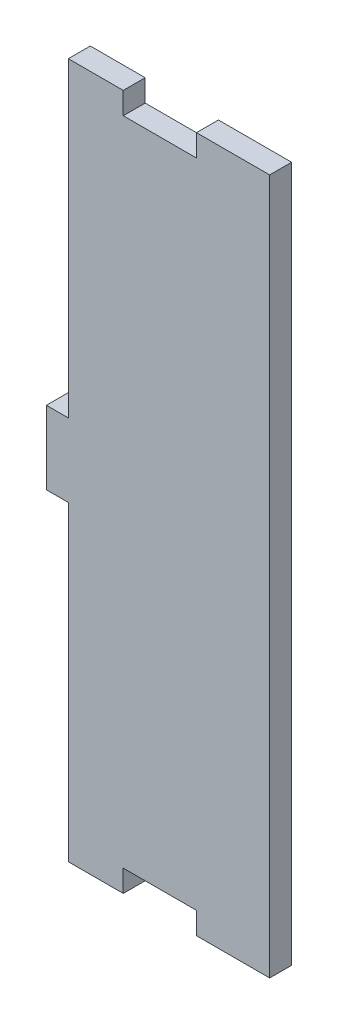
from build123d import *

# Parameters (mm, degrees)
BOSS_EXTRUDE1_DEPTH = 3


with BuildPart() as part:
    # Sketch1 → Boss-Extrude1 (new body)
    with BuildSketch(Plane.XY):
        Polygon((17.5, 47.5), (17.5, -2.5), (17.5, -12.5), (17.5, -47.5), (7.5, -47.5), (7.5, -44.5), (-2.5, -44.5), (-2.5, -47.5), (-10, -47.5), (-10, -5), (-13, -5), (-13, 5), (-10, 5), (-10, 47.5), (-2.5, 47.5), (-2.5, 44.5), (7.5, 44.5), (7.5, 47.5), align=None)
    extrude(amount=BOSS_EXTRUDE1_DEPTH)


solid = part.part
